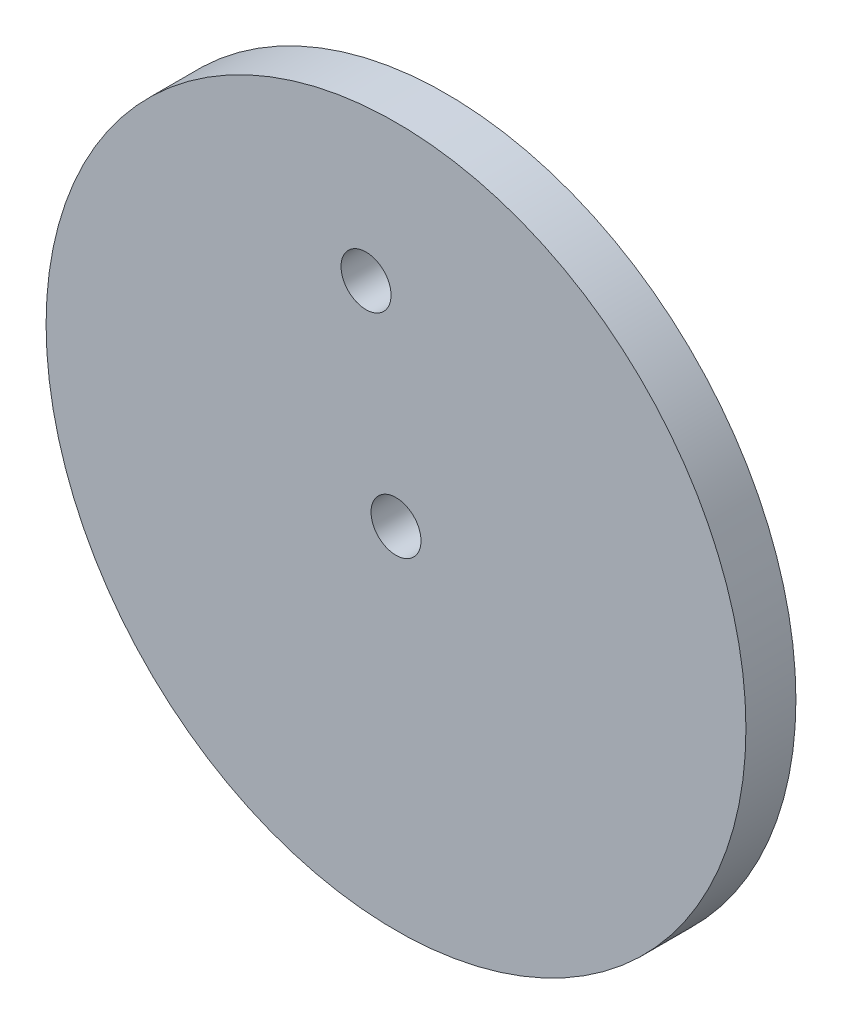
from build123d import *

# Parameters (mm, degrees)
SKETCH1_R           = 22.225
SKETCH1_R_2         = 1.5875
BOSS_EXTRUDE1_DEPTH = 3.175


with BuildPart() as part:
    # Sketch1 → Boss-Extrude1 (new body)
    with BuildSketch(Plane.XY):
        Circle(SKETCH1_R)
        Circle(SKETCH1_R_2, mode=Mode.SUBTRACT)
        with Locations((-1.903942476, 12.556472556)):
            Circle(SKETCH1_R_2, mode=Mode.SUBTRACT)
    extrude(amount=BOSS_EXTRUDE1_DEPTH)


solid = part.part
